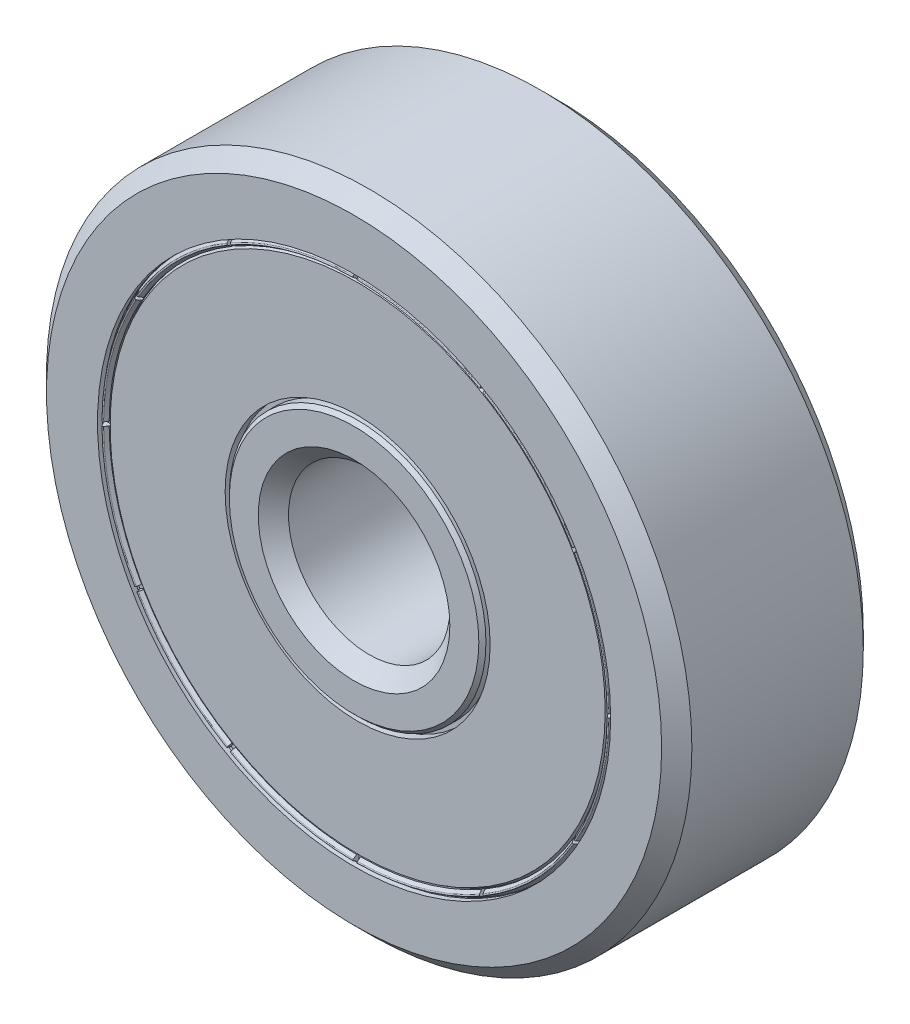
from build123d import *

# Parameters (mm, degrees)
CIRPATTERN1_COUNT  = 6
FILLET1_R          = 0.025
CUT_EXTRUDE1_START = 2.322872
CUT_EXTRUDE1_DEPTH = 10.263758226
CIRPATTERN2_COUNT  = 12


with BuildPart() as part:
    # Sketch3 → Revolve1 (revolve)
    with BuildSketch(Plane(origin=(0, 0, 0), x_dir=(0, 0, -1), z_dir=(1, 0, 0)), mode=Mode.PRIVATE) as revolve1_sk:
        with BuildLine():
            Line((2.125, 8), (-2.125, 8))
            Line((-2.125, 8), (-2.5, 7.625))
            Line((-2.5, 7.625), (-2.5, 6.360530001))
            Line((-2.5, 6.360530001), (-2.375, 6.360530001))
            Line((-2.375, 6.360530001), (-2.375, 6.730265))
            Line((-2.375, 6.730265), (-2.286611652, 6.818653348))
            Line((-2.286611652, 6.818653348), (-1.05, 6.818653348))
            ThreePointArc((-1.05, 6.818653348), (0, 7.1), (1.05, 6.818653348))
            Line((1.05, 6.818653348), (2.286611652, 6.818653348))
            Line((2.286611652, 6.818653348), (2.375, 6.730265))
            Line((2.375, 6.730265), (2.375, 6.360530001))
            Line((2.375, 6.360530001), (2.5, 6.360530001))
            Line((2.5, 6.360530001), (2.5, 7.625))
            Line((2.5, 7.625), (2.125, 8))
        make_face()
        with BuildLine():
            Line((2.125, 2), (-2.125, 2))
            Line((-2.125, 2), (-2.5, 2.375))
            Line((-2.5, 2.375), (-2.5, 3.092958304))
            Line((-2.5, 3.092958304), (-2.411611652, 3.181346652))
            Line((-2.411611652, 3.181346652), (-1.05, 3.181346652))
            ThreePointArc((-1.05, 3.181346652), (0, 2.9), (1.05, 3.181346652))
            Line((1.05, 3.181346652), (2.411611652, 3.181346652))
            Line((2.411611652, 3.181346652), (2.5, 3.092958304))
            Line((2.5, 3.092958304), (2.5, 2.375))
            Line((2.5, 2.375), (2.125, 2))
        make_face()
    revolve(revolve1_sk.sketch.rotate(Axis((0, 0, 2.5), (0, 0, -1)), 90), axis=Axis((0, 0, 2.5), (0, 0, -1)))


with BuildPart() as body_2:
    # Sketch4 → Revolve2 (revolve)
    with BuildSketch(Plane(origin=(0, 0, 0), x_dir=(0, 0, -1), z_dir=(1, 0, 0))):
        with BuildLine():
            Line((0, 7.1), (0, 2.9))
            ThreePointArc((0, 2.9), (-2.1, 5), (0, 7.1))
        make_face()
    revolve(axis=Axis((0, 8, 0), (0, -1, 0)))


with BuildPart() as cirpattern1_1:
    # CirPattern1: pattern copy
    add(body_2.part.rotate(Axis((0, 0, 0), (0, 0, 1)), 1 * 360 / CIRPATTERN1_COUNT))


with BuildPart() as cirpattern1_2:
    # CirPattern1: pattern copy
    add(body_2.part.rotate(Axis((0, 0, 0), (0, 0, 1)), 2 * 360 / CIRPATTERN1_COUNT))


with BuildPart() as cirpattern1_3:
    # CirPattern1: pattern copy
    add(body_2.part.rotate(Axis((0, 0, 0), (0, 0, 1)), 3 * 360 / CIRPATTERN1_COUNT))


with BuildPart() as cirpattern1_4:
    # CirPattern1: pattern copy
    add(body_2.part.rotate(Axis((0, 0, 0), (0, 0, 1)), 4 * 360 / CIRPATTERN1_COUNT))


with BuildPart() as cirpattern1_5:
    # CirPattern1: pattern copy
    add(body_2.part.rotate(Axis((0, 0, 0), (0, 0, 1)), 5 * 360 / CIRPATTERN1_COUNT))


with BuildPart() as body_8:
    # Sketch5 → Revolve3 (revolve)
    with BuildSketch(Plane(origin=(0, 0, 0), x_dir=(0, 0, -1), z_dir=(1, 0, 0)), mode=Mode.PRIVATE) as revolve3_sk:
        Polygon((-2.1, 3.181346652), (-2.203870551, 3.181346652), (-2.203870551, 3.285217203), (-2.411611652, 3.285217203), (-2.411611652, 6.136720069), (-2.203870551, 6.25665945), (-2.1, 6.25665945), align=None)
        Polygon((2.203870551, 6.25665945), (2.1, 6.25665945), (2.1, 3.181346652), (2.203870551, 3.181346652), (2.203870551, 3.285217203), (2.411611652, 3.285217203), (2.411611652, 6.136720069), align=None)
    revolve(revolve3_sk.sketch.rotate(Axis((0, 0, 2.5), (0, 0, -1)), 90), axis=Axis((0, 0, 2.5), (0, 0, -1)))


with BuildPart() as body_9:
    # Sketch6 → Revolve4 (revolve)
    with BuildSketch(Plane(origin=(0, 0, 0), x_dir=(0, 0, -1), z_dir=(1, 0, 0)), mode=Mode.PRIVATE) as revolve4_sk:
        Polygon((-2.311994104, 6.360530001), (-2.33375, 6.360530001), (-2.5, 6.264545518), (-2.386994104, 6.185417938), (-2.361994104, 6.185417938), (-2.311994104, 6.194234287), align=None)
    revolve(revolve4_sk.sketch.rotate(Axis((0, 0, 2.5), (0, 0, -1)), 90), axis=Axis((0, 0, 2.5), (0, 0, -1)))

    # Fillet1
    fillet1_edges = [body_9.edges().sort_by_distance(p)[0] for p in [
        (-6.264545518, 0, 2.5),
    ]]
    fillet(fillet1_edges, radius=FILLET1_R)

    # Sketch7 → Cut-Extrude1 (cut, through all)
    with BuildSketch(Plane.XY.offset(CUT_EXTRUDE1_START)):
        Polygon((-0.05, 6.360530001), (-0.05, 6.460530001), (0.05, 6.460530001), (0.05, 6.360530001), (0.05, 6.185417938), (0.05, 6.085417938), (-0.05, 6.085417938), (-0.05, 6.185417938), align=None)
    cut_extrude1 = extrude(amount=CUT_EXTRUDE1_DEPTH, mode=Mode.SUBTRACT)

    # CirPattern2: Cut-Extrude1 ×12 about axis
    cirpattern2_axis = Axis((0, 0, 2.5), (0, 0, -1))
    for i in range(1, CIRPATTERN2_COUNT):
        add(cut_extrude1.rotate(cirpattern2_axis, i * 360 / CIRPATTERN2_COUNT), mode=Mode.SUBTRACT)


with BuildPart() as body_10:
    # Mirror1: mirrored copy
    add(body_9.part.mirror(Plane.XY))


solid = Compound([part.part, body_2.part, cirpattern1_1.part, cirpattern1_2.part, cirpattern1_3.part, cirpattern1_4.part, cirpattern1_5.part, body_8.part, body_9.part, body_10.part])
